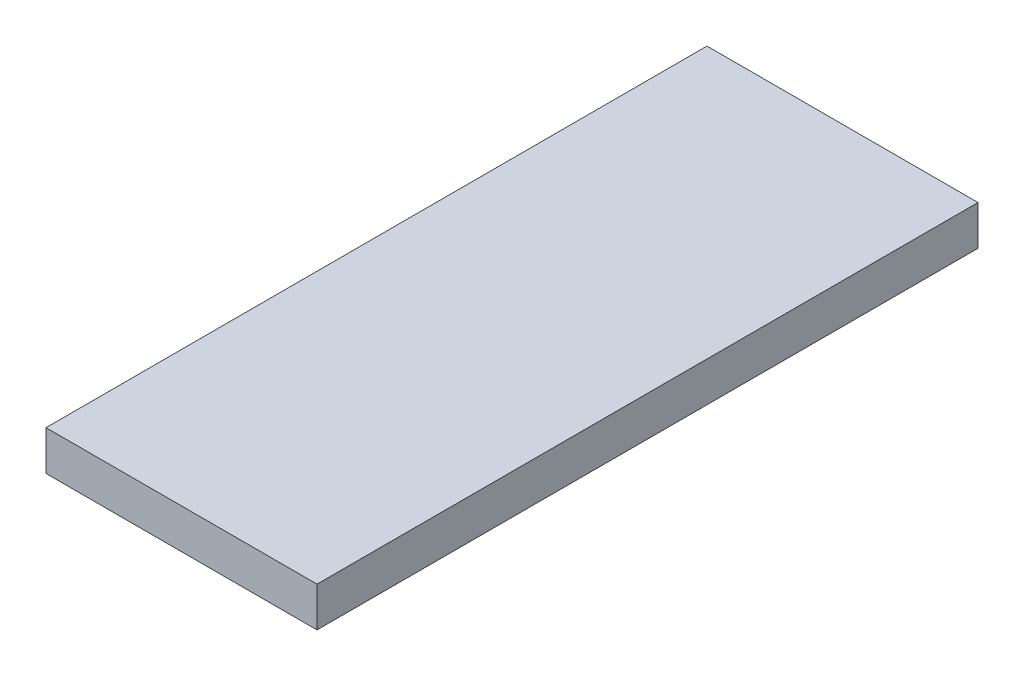
from build123d import *

# Parameters (mm, degrees)
SCHIZZO1_W                   = 8.2
SCHIZZO1_H                   = 1.2
ESTRUSIONE_ESTRUSIONE1_DEPTH = 20


with BuildPart() as part:
    # Schizzo1 → Estrusione-Estrusione1 (new body)
    with BuildSketch(Plane.XY):
        Rectangle(SCHIZZO1_W, SCHIZZO1_H)
    extrude(amount=ESTRUSIONE_ESTRUSIONE1_DEPTH)


solid = part.part
